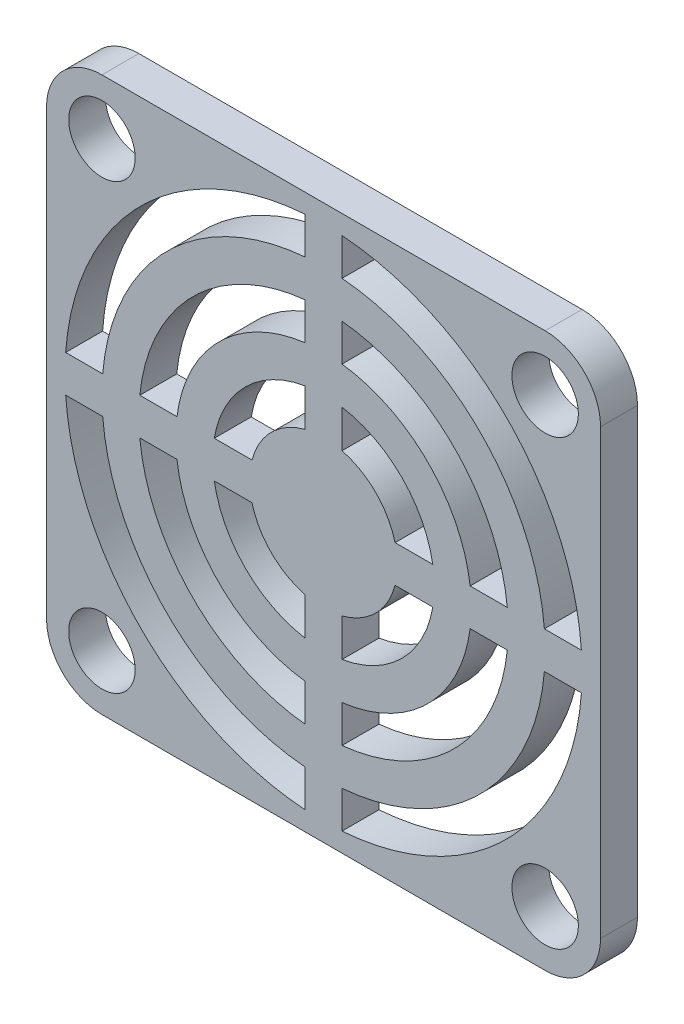
from build123d import *

# Parameters (mm, degrees)
SKETCH1_W           = 30
SKETCH1_H           = 30
BOSS_EXTRUDE1_DEPTH = 2
SKETCH2_R           = 1.8
CUT_EXTRUDE1_DEPTH  = 22.307275753
FILLET1_R           = 3
CUT_EXTRUDE2_DEPTH  = 22.307275753


with BuildPart() as part:
    # Sketch1 → Boss-Extrude1 (new body)
    with BuildSketch(Plane.XY):
        Rectangle(SKETCH1_W, SKETCH1_H)
    extrude(amount=BOSS_EXTRUDE1_DEPTH)

    # Sketch2 → Cut-Extrude1 (cut, through all)
    with BuildSketch(Plane.XY.offset(2)):
        with Locations((-12, 12)):
            Circle(SKETCH2_R)
        with Locations((12, 12)):
            Circle(SKETCH2_R)
        with Locations((12, -12)):
            Circle(SKETCH2_R)
        with Locations((-12, -12)):
            Circle(SKETCH2_R)
    extrude(amount=-CUT_EXTRUDE1_DEPTH, mode=Mode.SUBTRACT)

    # Fillet1
    fillet1_edges = [part.edges().sort_by_distance(p)[0] for p in [
        (15, -15, 1),
        (-15, -15, 1),
        (-15, 15, 1),
        (15, 15, 1),
    ]]
    fillet(fillet1_edges, radius=FILLET1_R)

    # Sketch3 → Cut-Extrude2 (cut, through all)
    with BuildSketch(Plane.XY.offset(2)):
        with BuildLine():
            Line((-7.937253933, 1), (-9.949874371, 1))
            ThreePointArc((-9.949874371, 1), (-7.071067812, 7.071067812), (-1, 9.949874371))
            Line((-1, 9.949874371), (-1, 7.937253933))
            ThreePointArc((-1, 7.937253933), (-5.656854249, 5.656854249), (-7.937253933, 1))
        make_face()
        with BuildLine():
            Line((-1, -3.872983346), (-1, -5.916079783))
            ThreePointArc((-1, -5.916079783), (-4.242640687, -4.242640687), (-5.916079783, -1))
            Line((-5.916079783, -1), (-3.872983346, -1))
            ThreePointArc((-3.872983346, -1), (-2.828427125, -2.828427125), (-1, -3.872983346))
        make_face()
        with BuildLine():
            Line((-3.872983346, 1), (-5.916079783, 1))
            ThreePointArc((-5.916079783, 1), (-4.242640687, 4.242640687), (-1, 5.916079783))
            Line((-1, 5.916079783), (-1, 3.872983346))
            ThreePointArc((-1, 3.872983346), (-2.828427125, 2.828427125), (-3.872983346, 1))
        make_face()
        with BuildLine():
            Line((3.872983346, -1), (5.916079783, -1))
            ThreePointArc((5.916079783, -1), (4.242640687, -4.242640687), (1, -5.916079783))
            Line((1, -5.916079783), (1, -3.872983346))
            ThreePointArc((1, -3.872983346), (2.828427125, -2.828427125), (3.872983346, -1))
        make_face()
        with BuildLine():
            Line((3.872983346, 1), (5.916079783, 1))
            ThreePointArc((5.916079783, 1), (4.242640687, 4.242640687), (1, 5.916079783))
            Line((1, 5.916079783), (1, 3.872983346))
            ThreePointArc((1, 3.872983346), (2.828427125, 2.828427125), (3.872983346, 1))
        make_face()
        with BuildLine():
            Line((-11.958260743, 1), (-13.964240044, 1))
            ThreePointArc((-13.964240044, 1), (-9.899494937, 9.899494937), (-1, 13.964240044))
            Line((-1, 13.964240044), (-1, 11.958260743))
            ThreePointArc((-1, 11.958260743), (-8.485281374, 8.485281374), (-11.958260743, 1))
        make_face()
        with BuildLine():
            Line((1, 11.958260743), (1, 13.964240044))
            ThreePointArc((1, 13.964240044), (9.899494937, 9.899494937), (13.964240044, 1))
            Line((13.964240044, 1), (11.958260743, 1))
            ThreePointArc((11.958260743, 1), (8.485281374, 8.485281374), (1, 11.958260743))
        make_face()
        with BuildLine():
            Line((1, 7.937253933), (1, 9.949874371))
            ThreePointArc((1, 9.949874371), (7.071067812, 7.071067812), (9.949874371, 1))
            Line((9.949874371, 1), (7.937253933, 1))
            ThreePointArc((7.937253933, 1), (5.656854249, 5.656854249), (1, 7.937253933))
        make_face()
        with BuildLine():
            Line((7.937253933, -1), (9.949874371, -1))
            ThreePointArc((9.949874371, -1), (7.071067812, -7.071067812), (1, -9.949874371))
            Line((1, -9.949874371), (1, -7.937253933))
            ThreePointArc((1, -7.937253933), (5.656854249, -5.656854249), (7.937253933, -1))
        make_face()
        with BuildLine():
            Line((11.958260743, -1), (13.964240044, -1))
            ThreePointArc((13.964240044, -1), (9.899494937, -9.899494937), (1, -13.964240044))
            Line((1, -13.964240044), (1, -11.958260743))
            ThreePointArc((1, -11.958260743), (8.485281374, -8.485281374), (11.958260743, -1))
        make_face()
        with BuildLine():
            Line((-1, -11.958260743), (-1, -13.964240044))
            ThreePointArc((-1, -13.964240044), (-9.899494937, -9.899494937), (-13.964240044, -1))
            Line((-13.964240044, -1), (-11.958260743, -1))
            ThreePointArc((-11.958260743, -1), (-8.485281374, -8.485281374), (-1, -11.958260743))
        make_face()
        with BuildLine():
            Line((-1, -7.937253933), (-1, -9.949874371))
            ThreePointArc((-1, -9.949874371), (-7.071067812, -7.071067812), (-9.949874371, -1))
            Line((-9.949874371, -1), (-7.937253933, -1))
            ThreePointArc((-7.937253933, -1), (-5.656854249, -5.656854249), (-1, -7.937253933))
        make_face()
    extrude(amount=-CUT_EXTRUDE2_DEPTH, mode=Mode.SUBTRACT)


solid = part.part
